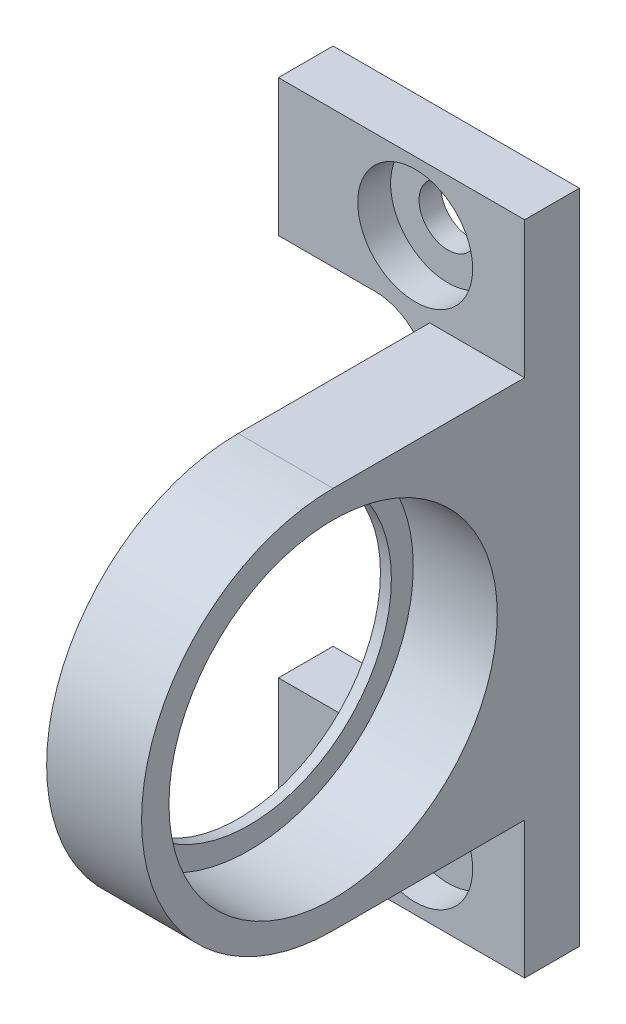
from build123d import *

# Parameters (mm, degrees)
EXTRUDE_2_DEPTH                = 5
SKETCH_4_W                     = 8.676470589
SKETCH_4_H                     = 35
SKETCH_4_W_2                   = 8.676470588
EXTRUDE_15_DEPTH               = 35
CUT_EXTRUDE_1_DEPTH            = 45
SKETCH_6_R                     = 15
CUT_EXTRUDE_2_DEPTH            = 45
FILLET_1_R                     = 5
EXTRUDE_START                  = -1
SKETCH_7_R                     = 15
SKETCH_7_R_2                   = 13
EXTRUDE_16_DEPTH               = 1
SKETCH_8_R                     = 15
SKETCH_8_R_2                   = 13
EXTRUDE_17_DEPTH               = 1
SPLIT_BODIES_1_SURFACE_1_BACK  = 86
SPLIT_BODIES_1_SURFACE_1_DEPTH = 172
SPLIT_BODIES_1_SURFACE_2_BACK  = 86
SPLIT_BODIES_1_SURFACE_2_DEPTH = 172
HOLE_WIZARD_1_D                = 5.3
HOLE_WIZARD_1_CBORE_D          = 10.5
HOLE_WIZARD_1_CBORE_DEPTH      = 3


with BuildPart() as part:
    # 草图2 → 凸台-拉伸2 (new body)
    with BuildSketch(Plane.XY):
        Polygon((7.726423565, 24.338235294), (-14.773576435, 24.338235294), (-14.773576435, -35.661764706), (7.726423565, -35.661764706), (7.726423565, -23.161764706), (-6.097105846, -23.161764706), (-6.097105846, 11.838235294), (7.726423565, 11.838235294), align=None)
        Polygon((30.226423565, 24.338235294), (7.726423565, 24.338235294), (7.726423565, 11.838235294), (21.549952977, 11.838235294), (21.549952977, -23.161764706), (7.726423565, -23.161764706), (7.726423565, -35.661764706), (30.226423565, -35.661764706), align=None)
    extrude(amount=EXTRUDE_2_DEPTH)

    # 草图4 → 凸台-拉伸15 (add)
    with BuildSketch(Plane.XY.offset(5)):
        with Locations((-10.435341141, -5.661764706)):
            Rectangle(SKETCH_4_W, SKETCH_4_H)
        with Locations((25.888188271, -5.661764706)):
            Rectangle(SKETCH_4_W_2, SKETCH_4_H)
    extrude(amount=EXTRUDE_15_DEPTH)

    # 草图5 → 切除-拉伸1 (cut)
    with BuildSketch(Plane.ZY.offset(14.773576435)):
        with BuildLine():
            Line((40, -23.161764706), (40, -5.661764706))
            ThreePointArc((40, -5.661764706), (34.874368671, -18.036133377), (22.5, -23.161764706))
            Line((22.5, -23.161764706), (40, -23.161764706))
        make_face()
        with BuildLine():
            ThreePointArc((22.5, 11.838235294), (34.874368671, 6.712603965), (40, -5.661764706))
            Line((40, -5.661764706), (40, 11.838235294))
            Line((40, 11.838235294), (22.5, 11.838235294))
        make_face()
    extrude(amount=-CUT_EXTRUDE_1_DEPTH, mode=Mode.SUBTRACT)

    # 草图6 → 切除-拉伸2 (cut)
    with BuildSketch(Plane.ZY.offset(14.773576435)):
        with Locations((22.5, -5.661764706)):
            Circle(SKETCH_6_R)
    extrude(amount=-CUT_EXTRUDE_2_DEPTH, mode=Mode.SUBTRACT)

    # 圆角1
    fillet_1_edges = [part.edges().sort_by_distance(p)[0] for p in [
        (-6.097105846, 11.838235294, 2.5),
        (-6.097105846, -23.161764706, 2.5),
        (21.549952977, -23.161764706, 2.5),
        (21.549952977, 11.838235294, 2.5),
    ]]
    fillet(fillet_1_edges, radius=FILLET_1_R)

    # 草图7 → 凸台-拉伸16 (add)
    with BuildSketch(Plane(origin=(-6.097105846, 0, 0), x_dir=(0, 0, -1), z_dir=(1, 0, 0)).offset(EXTRUDE_START)):
        with Locations(Location((-22.5, -5.661764706, 0), (0, 0, 180))):
            Circle(SKETCH_7_R)
        with Locations((-22.5, -5.661764706)):
            Circle(SKETCH_7_R_2, mode=Mode.SUBTRACT)
    extrude(amount=EXTRUDE_16_DEPTH)

    # 草图8 → 凸台-拉伸17 (add)
    with BuildSketch(Plane.ZY.offset(-21.549952977)):
        with Locations((22.5, -5.661764706)):
            Circle(SKETCH_8_R)
        with Locations(Location((22.5, -5.661764706, 0), (0, 0, 180))):
            Circle(SKETCH_8_R_2, mode=Mode.SUBTRACT)
    extrude(amount=-EXTRUDE_17_DEPTH)


with BuildPart() as body_2:
    # Split Bodies 1: the piece behind the surface
    add(part.part)
    # Split Bodies 1 surface: a surface, the sketch's curves swept straight by 172 mm
    with BuildLine(Plane.XY.offset(5).offset(-SPLIT_BODIES_1_SURFACE_1_BACK), mode=Mode.PRIVATE) as split_bodies_1_surface_1_path:
        Line((7.726423565, 24.338235294), (7.726423565, -35.661764706))
    split_bodies_1_surface_1 = Shell.extrude(split_bodies_1_surface_1_path.wire(), (0 * SPLIT_BODIES_1_SURFACE_1_DEPTH, 0 * SPLIT_BODIES_1_SURFACE_1_DEPTH, 1 * SPLIT_BODIES_1_SURFACE_1_DEPTH))
    split(bisect_by=split_bodies_1_surface_1, keep=Keep.BOTTOM)


with BuildPart() as part_1:
    add(part.part)

    # Split Bodies 1: split by a surface, the side it looks to stays
    # Split Bodies 1 surface: a surface, the sketch's curves swept straight by 172 mm
    with BuildLine(Plane.XY.offset(5).offset(-SPLIT_BODIES_1_SURFACE_2_BACK), mode=Mode.PRIVATE) as split_bodies_1_surface_2_path:
        Line((7.726423565, 24.338235294), (7.726423565, -35.661764706))
    split_bodies_1_surface_2 = Shell.extrude(split_bodies_1_surface_2_path.wire(), (0 * SPLIT_BODIES_1_SURFACE_2_DEPTH, 0 * SPLIT_BODIES_1_SURFACE_2_DEPTH, 1 * SPLIT_BODIES_1_SURFACE_2_DEPTH))
    split(bisect_by=split_bodies_1_surface_2, keep=Keep.TOP)

    # 大小平盘开槽螺钉柱孔1 (through all)
    with Locations(Plane(origin=(20.226423565, -29.411764706, 5), x_dir=(1, 0, 0), z_dir=(0, 0, 1))):
        with Locations((0, 0), (0, 47.5)):
            CounterBoreHole(HOLE_WIZARD_1_D / 2, HOLE_WIZARD_1_CBORE_D / 2, HOLE_WIZARD_1_CBORE_DEPTH)


solid = part_1.part
